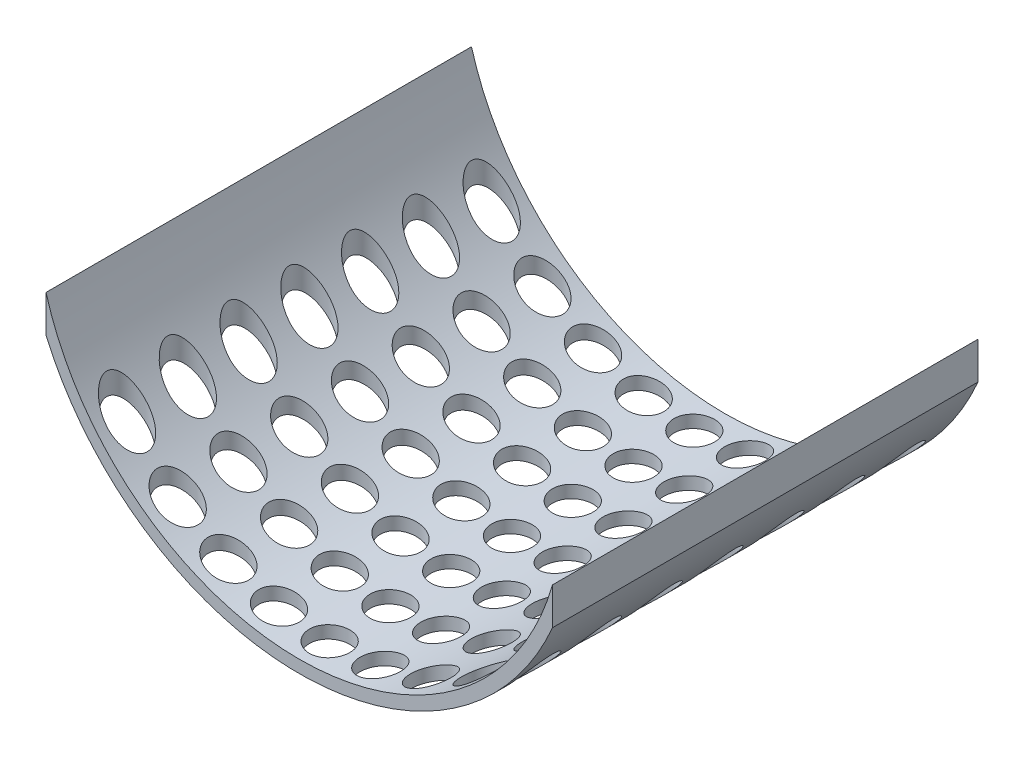
from build123d import *

# Parameters (mm, degrees)
BOSS_EXTRUDE1_DEPTH = 105
SKETCH2_R           = 10
CUT_EXTRUDE1_DEPTH  = 200


with BuildPart() as part:
    # Sketch1 → Boss-Extrude1 (new, symmetric)
    with BuildSketch(Plane.XY):
        with BuildLine():
            Line((-125, -35.707142143), (-125, -54.024352148))
            ThreePointArc((-125, -54.024352148), (0, -136.175), (125, -54.024352148))
            Line((125, -54.024352148), (125, -35.707142143))
            ThreePointArc((125, -35.707142143), (0, -130), (-125, -35.707142143))
        make_face()
    extrude(amount=BOSS_EXTRUDE1_DEPTH, both=True)

    # Sketch2 → Cut-Extrude1 (cut)
    with BuildSketch(Plane(origin=(0, 0, 0), x_dir=(1, 0, 0), z_dir=(0, 1, 0))):
        with Locations(Location((0, 0, 0), (0, 0, 270))):
            Circle(SKETCH2_R)
        with Locations(Location((25, 0, 0), (0, 0, 270))):
            Circle(SKETCH2_R)
        with Locations(Location((50, 0, 0), (0, 0, 270))):
            Circle(SKETCH2_R)
        with Locations(Location((75, 0, 0), (0, 0, 270))):
            Circle(SKETCH2_R)
        with Locations(Location((100, 0, 0), (0, 0, 270))):
            Circle(SKETCH2_R)
        with Locations(Location((25, 30, 0), (0, 0, 270))):
            Circle(SKETCH2_R)
        with Locations(Location((50, 30, 0), (0, 0, 270))):
            Circle(SKETCH2_R)
        with Locations(Location((75, 30, 0), (0, 0, 270))):
            Circle(SKETCH2_R)
        with Locations(Location((100, 30, 0), (0, 0, 270))):
            Circle(SKETCH2_R)
        with Locations(Location((25, 60, 0), (0, 0, 270))):
            Circle(SKETCH2_R)
        with Locations(Location((50, 60, 0), (0, 0, 270))):
            Circle(SKETCH2_R)
        with Locations(Location((75, 60, 0), (0, 0, 270))):
            Circle(SKETCH2_R)
        with Locations(Location((100, 60, 0), (0, 0, 270))):
            Circle(SKETCH2_R)
        with Locations(Location((25, 90, 0), (0, 0, 270))):
            Circle(SKETCH2_R)
        with Locations(Location((50, 90, 0), (0, 0, 270))):
            Circle(SKETCH2_R)
        with Locations(Location((75, 90, 0), (0, 0, 270))):
            Circle(SKETCH2_R)
        with Locations(Location((100, 90, 0), (0, 0, 270))):
            Circle(SKETCH2_R)
        with Locations(Location((0, 30, 0), (0, 0, 270))):
            Circle(SKETCH2_R)
        with Locations(Location((0, 60, 0), (0, 0, 270))):
            Circle(SKETCH2_R)
        with Locations(Location((0, 90, 0), (0, 0, 270))):
            Circle(SKETCH2_R)
        with Locations(Location((0, -90, 0), (0, 0, 270))):
            Circle(SKETCH2_R)
        with Locations(Location((0, -60, 0), (0, 0, 270))):
            Circle(SKETCH2_R)
        with Locations(Location((0, -30, 0), (0, 0, 270))):
            Circle(SKETCH2_R)
        with Locations(Location((100, -90, 0), (0, 0, 270))):
            Circle(SKETCH2_R)
        with Locations(Location((75, -90, 0), (0, 0, 270))):
            Circle(SKETCH2_R)
        with Locations(Location((50, -90, 0), (0, 0, 270))):
            Circle(SKETCH2_R)
        with Locations(Location((25, -90, 0), (0, 0, 270))):
            Circle(SKETCH2_R)
        with Locations(Location((100, -60, 0), (0, 0, 270))):
            Circle(SKETCH2_R)
        with Locations(Location((75, -60, 0), (0, 0, 270))):
            Circle(SKETCH2_R)
        with Locations(Location((50, -60, 0), (0, 0, 270))):
            Circle(SKETCH2_R)
        with Locations(Location((25, -60, 0), (0, 0, 270))):
            Circle(SKETCH2_R)
        with Locations(Location((100, -30, 0), (0, 0, 270))):
            Circle(SKETCH2_R)
        with Locations(Location((75, -30, 0), (0, 0, 270))):
            Circle(SKETCH2_R)
        with Locations(Location((50, -30, 0), (0, 0, 270))):
            Circle(SKETCH2_R)
        with Locations(Location((25, -30, 0), (0, 0, 270))):
            Circle(SKETCH2_R)
        with Locations(Location((-25, -30, 0), (0, 0, 270))):
            Circle(SKETCH2_R)
        with Locations(Location((-50, -30, 0), (0, 0, 270))):
            Circle(SKETCH2_R)
        with Locations(Location((-75, -30, 0), (0, 0, 270))):
            Circle(SKETCH2_R)
        with Locations(Location((-100, -30, 0), (0, 0, 270))):
            Circle(SKETCH2_R)
        with Locations(Location((-25, -60, 0), (0, 0, 270))):
            Circle(SKETCH2_R)
        with Locations(Location((-50, -60, 0), (0, 0, 270))):
            Circle(SKETCH2_R)
        with Locations(Location((-75, -60, 0), (0, 0, 270))):
            Circle(SKETCH2_R)
        with Locations(Location((-100, -60, 0), (0, 0, 270))):
            Circle(SKETCH2_R)
        with Locations(Location((-25, -90, 0), (0, 0, 270))):
            Circle(SKETCH2_R)
        with Locations(Location((-50, -90, 0), (0, 0, 270))):
            Circle(SKETCH2_R)
        with Locations(Location((-75, -90, 0), (0, 0, 270))):
            Circle(SKETCH2_R)
        with Locations(Location((-100, -90, 0), (0, 0, 270))):
            Circle(SKETCH2_R)
        with Locations(Location((-100, 90, 0), (0, 0, 270))):
            Circle(SKETCH2_R)
        with Locations(Location((-75, 90, 0), (0, 0, 270))):
            Circle(SKETCH2_R)
        with Locations(Location((-50, 90, 0), (0, 0, 270))):
            Circle(SKETCH2_R)
        with Locations(Location((-25, 90, 0), (0, 0, 270))):
            Circle(SKETCH2_R)
        with Locations(Location((-100, 60, 0), (0, 0, 270))):
            Circle(SKETCH2_R)
        with Locations(Location((-75, 60, 0), (0, 0, 270))):
            Circle(SKETCH2_R)
        with Locations(Location((-50, 60, 0), (0, 0, 270))):
            Circle(SKETCH2_R)
        with Locations(Location((-25, 60, 0), (0, 0, 270))):
            Circle(SKETCH2_R)
        with Locations(Location((-100, 30, 0), (0, 0, 270))):
            Circle(SKETCH2_R)
        with Locations(Location((-75, 30, 0), (0, 0, 270))):
            Circle(SKETCH2_R)
        with Locations(Location((-50, 30, 0), (0, 0, 270))):
            Circle(SKETCH2_R)
        with Locations(Location((-25, 30, 0), (0, 0, 270))):
            Circle(SKETCH2_R)
        with Locations(Location((-100, 0, 0), (0, 0, 270))):
            Circle(SKETCH2_R)
        with Locations(Location((-75, 0, 0), (0, 0, 270))):
            Circle(SKETCH2_R)
        with Locations(Location((-50, 0, 0), (0, 0, 270))):
            Circle(SKETCH2_R)
        with Locations(Location((-25, 0, 0), (0, 0, 270))):
            Circle(SKETCH2_R)
    extrude(amount=-CUT_EXTRUDE1_DEPTH, mode=Mode.SUBTRACT)


solid = part.part
